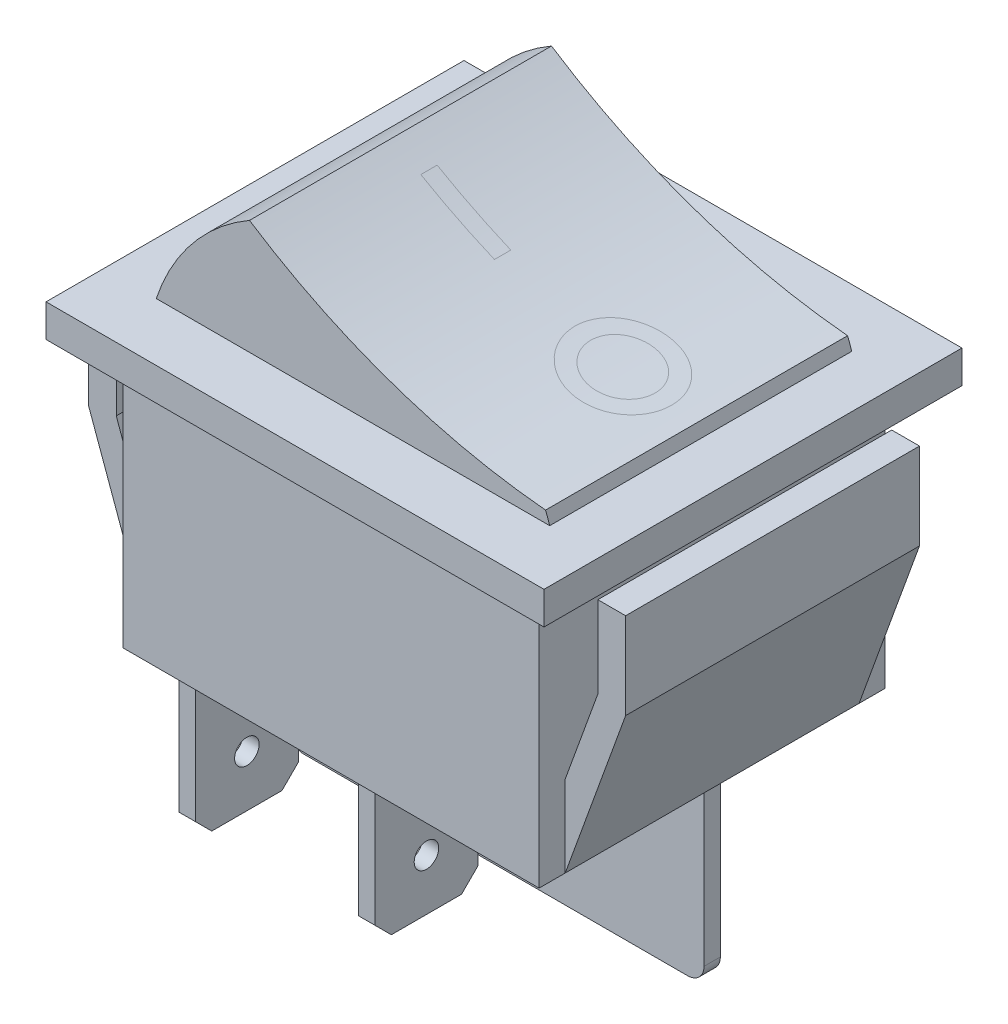
from build123d import *

# Parameters (mm, degrees)
SKETCH1_W                = 25.5
SKETCH1_H                = 21.2
BOSS_EXTRUDE1_DEPTH      = 16.2
SKETCH3_W                = 30.5
SKETCH3_H                = 25.6
BOSS_EXTRUDE2_DEPTH      = 2
BOSS_EXTRUDE3_DEPTH      = 9.25
BOSS_EXTRUDE4_DEPTH      = 0.5
BOSS_EXTRUDE4_DEPTH_BACK = 11.5
SKETCH6_R                = 0.75
CUT_EXTRUDE1_DEPTH       = 37.291080171
CUT_EXTRUDE1_DEPTH_BACK  = 37.291080171
SKETCH7_W                = 10
SKETCH7_H                = 10.2
BOSS_EXTRUDE5_DEPTH      = 0.5
BOSS_EXTRUDE6_DEPTH      = 9


with BuildPart() as part:
    # Sketch1 → Boss-Extrude1 (new body)
    with BuildSketch(Plane(origin=(0, 0, 0), x_dir=(1, 0, 0), z_dir=(0, 1, 0))):
        Rectangle(SKETCH1_W, SKETCH1_H)
    extrude(amount=BOSS_EXTRUDE1_DEPTH)

    # Sketch3 → Boss-Extrude2 (add)
    with BuildSketch(Plane(origin=(0, 16.2, 0), x_dir=(1, 0, 0), z_dir=(0, 1, 0))):
        Rectangle(SKETCH3_W, SKETCH3_H)
    extrude(amount=BOSS_EXTRUDE2_DEPTH)

    # Sketch4 → Boss-Extrude3 (add, symmetric)
    with BuildSketch(Plane.XY):
        with BuildLine():
            Line((-12.05, 18.2), (12.05, 18.2))
            ThreePointArc((12.05, 18.2), (11.927434436, 18.551874053), (11.79459622, 18.9))
            ThreePointArc((11.79459622, 18.9), (2.343455936, 20.945857513), (-6.340544141, 25.2))
            ThreePointArc((-6.340544141, 25.2), (-9.838853005, 22.224928134), (-12.05, 18.2))
        make_face()
    extrude(amount=BOSS_EXTRUDE3_DEPTH, both=True)

    # Sketch6 → Boss-Extrude4 (add, two sides: drawn at the far end of the back side and taken through both)
    # profile 1 of 2: a face of its own
    with BuildSketch(Plane(origin=(0, 0, 0), x_dir=(0, 0, -1), z_dir=(1, 0, 0)).offset(-BOSS_EXTRUDE4_DEPTH_BACK)):
        Polygon((-8.4, 0), (-8.4, -9.2), (-7.4, -10.2), (-3.1, -10.2), (-2.1, -9.2), (-2.1, 0), align=None)
        with Locations((-5.25, -7.05)):
            Circle(SKETCH6_R, mode=Mode.SUBTRACT)
    # profile 2 of 2: a face of its own
    with BuildSketch(Plane(origin=(0, 0, 0), x_dir=(0, 0, -1), z_dir=(1, 0, 0)).offset(-BOSS_EXTRUDE4_DEPTH_BACK)):
        Polygon((2.1, -9.2), (2.1, 0), (8.4, 0), (8.4, -9.2), (7.4, -10.2), (3.1, -10.2), align=None)
        with Locations(Location((5.25, -7.05, 0), (0, 0, 180))):
            Circle(SKETCH6_R, mode=Mode.SUBTRACT)
    extrude(amount=BOSS_EXTRUDE4_DEPTH + BOSS_EXTRUDE4_DEPTH_BACK)

    # Sketch7 → Cut-Extrude1 (cut, two sides: drawn at the far end of the back side and taken through both)
    with BuildSketch(Plane.XY.offset(8.4).offset(-CUT_EXTRUDE1_DEPTH_BACK)):
        with Locations((-5.5, -5.1)):
            Rectangle(SKETCH7_W, SKETCH7_H)
    extrude(amount=CUT_EXTRUDE1_DEPTH + CUT_EXTRUDE1_DEPTH_BACK, mode=Mode.SUBTRACT)

    # Sketch8 → Boss-Extrude5 (add, symmetric)
    with BuildSketch(Plane.XY):
        with BuildLine():
            Line((-12.75, 0), (12.75, 0))
            Line((12.75, 0), (12.75, -9.2))
            ThreePointArc((12.75, -9.2), (12.457106781, -9.907106781), (11.75, -10.2))
            Line((11.75, -10.2), (-11.75, -10.2))
            ThreePointArc((-11.75, -10.2), (-12.457106781, -9.907106781), (-12.75, -9.2))
            Line((-12.75, -9.2), (-12.75, 0))
        make_face()
    extrude(amount=BOSS_EXTRUDE5_DEPTH, both=True)

    # Sketch9 → Boss-Extrude6 (add, symmetric)
    with BuildSketch(Plane.XY):
        Polygon((-16.45, 15.5), (-14.75, 15.5), (-14.75, 10.5), (-12.75, 4.985823609), (-12.75, 0), (-16.45, 10.201226322), align=None)
        Polygon((12.75, 0), (16.45, 10.201226322), (16.45, 15.5), (14.75, 15.5), (14.75, 10.5), (12.75, 4.985823609), align=None)
    extrude(amount=BOSS_EXTRUDE6_DEPTH, both=True)


solid = part.part
